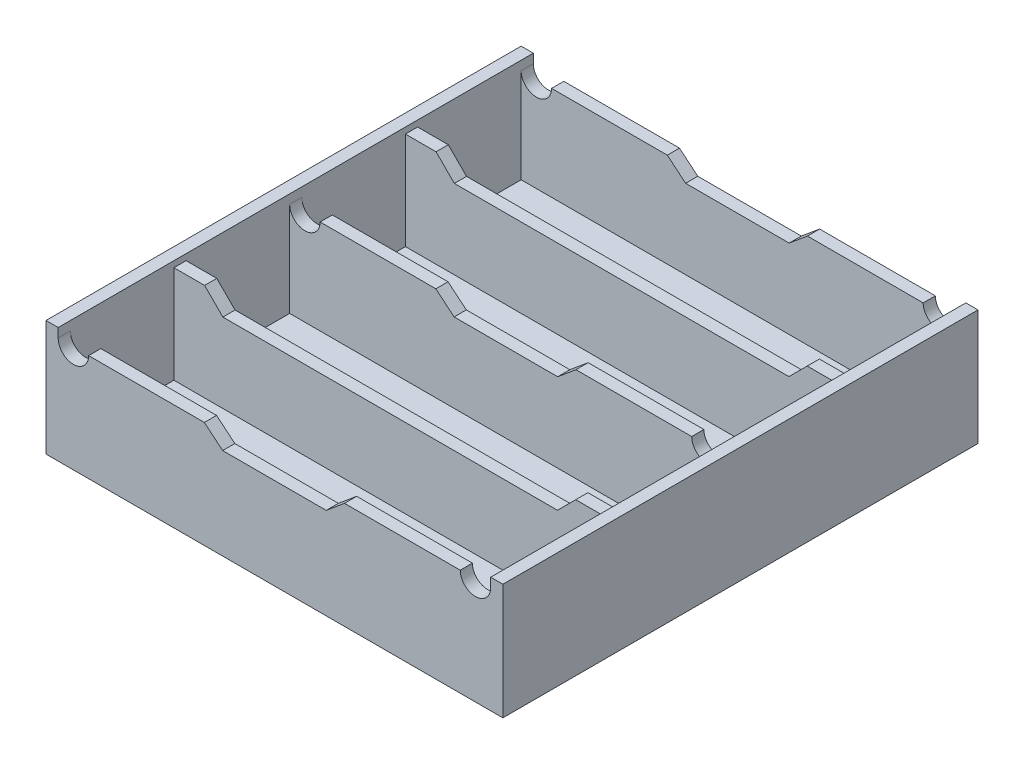
from build123d import *

# Parameters (mm, degrees)
SKETCH1_W            = 75
SKETCH1_H            = 40
BOSS_EXTRUDE1_DEPTH  = 2
SKETCH2_W            = 75
SKETCH2_H            = 40
SKETCH2_W_2          = 71
SKETCH2_H_2          = 17
BOSS_EXTRUDE2_DEPTH  = 17
CUT_EXTRUDE2_DEPTH   = 17
CUT_EXTRUDE3_REACH   = 82.169
CUT_EXTRUDE4_REACH   = 88.683
SKETCH5_R            = 1.6
MIRROR2_COPY_1_DEPTH = 17


with BuildPart() as part:
    # Sketch1 → Boss-Extrude1 (new body)
    with BuildSketch(Plane(origin=(0, 0, 0), x_dir=(1, 0, 0), z_dir=(0, 1, 0))):
        with Locations((37.5, 20)):
            Rectangle(SKETCH1_W, SKETCH1_H)
    boss_extrude1 = extrude(amount=BOSS_EXTRUDE1_DEPTH)

    # Sketch2 → Boss-Extrude2 (add)
    with BuildSketch(Plane(origin=(0, 2, 0), x_dir=(1, 0, 0), z_dir=(0, 1, 0))):
        with Locations((37.5, 20)):
            Rectangle(SKETCH2_W, SKETCH2_H)
        with Locations((37.5, 29.5)):
            Rectangle(SKETCH2_W_2, SKETCH2_H_2, mode=Mode.SUBTRACT)
        with Locations((37.5, 10.5)):
            Rectangle(SKETCH2_W_2, SKETCH2_H_2, mode=Mode.SUBTRACT)
    boss_extrude2 = extrude(amount=BOSS_EXTRUDE2_DEPTH)

    # Sketch3 → Cut-Extrude2 (cut)
    with BuildSketch(Plane.XY):
        with BuildLine():
            Line((2, 17.5), (2, 19))
            Line((2, 19), (73, 19))
            Line((73, 19), (73, 17.5))
            ThreePointArc((73, 17.5), (70.5, 15), (68, 17.5))
            Line((68, 17.5), (49, 17.5))
            Line((49, 17.5), (46, 15))
            Line((46, 15), (29, 15))
            Line((29, 15), (26, 17.5))
            Line((26, 17.5), (7, 17.5))
            ThreePointArc((7, 17.5), (4.5, 15), (2, 17.5))
        make_face()
    cut_extrude2 = extrude(amount=-CUT_EXTRUDE2_DEPTH, mode=Mode.SUBTRACT)

    # Mirror1: Cut-Extrude2 across plane
    add(cut_extrude2.mirror(Plane.XY.offset(-20)), mode=Mode.SUBTRACT)

    # Sketch4 → Cut-Extrude3 (cut, up to next)
    with BuildSketch(Plane.XY.offset(-19), mode=Mode.PRIVATE) as cut_extrude3_sk1:
        Polygon((2, 18), (7.035918341, 18), (10.035918341, 15), (64.964081659, 15), (67.964081659, 18), (73, 18), (73, 19), (2, 19), align=None)
    cut_extrude3_tool1 = extrude(cut_extrude3_sk1.sketch, amount=-CUT_EXTRUDE3_REACH, mode=Mode.PRIVATE) & part.part
    cut_extrude3 = cut_extrude3_tool1.solids().sort_by_distance((37.5, 17.098486, -19))[0]
    add(cut_extrude3, mode=Mode.SUBTRACT)

    # Sketch5 → Cut-Extrude4 (cut, up to next)
    with BuildSketch(Plane(origin=(0, 2, 0), x_dir=(1, 0, 0), z_dir=(0, 1, 0)), mode=Mode.PRIVATE) as cut_extrude4_sk1:
        with Locations(Location((37.5, 29.5, 0), (0, 0, 270))):
            Circle(SKETCH5_R)
    cut_extrude4_tool1 = extrude(cut_extrude4_sk1.sketch, amount=-CUT_EXTRUDE4_REACH, mode=Mode.PRIVATE) & part.part
    # Sketch5 → Cut-Extrude4 (cut, up to next)
    with BuildSketch(Plane(origin=(0, 2, 0), x_dir=(1, 0, 0), z_dir=(0, 1, 0)), mode=Mode.PRIVATE) as cut_extrude4_sk2:
        with Locations(Location((37.5, 10.5, 0), (0, 0, 270))):
            Circle(SKETCH5_R)
    cut_extrude4_tool2 = extrude(cut_extrude4_sk2.sketch, amount=-CUT_EXTRUDE4_REACH, mode=Mode.PRIVATE) & part.part
    cut_extrude4_1 = cut_extrude4_tool1.solids().sort_by_distance((37.5, 2, -29.5))[0]
    add(cut_extrude4_1, mode=Mode.SUBTRACT)
    cut_extrude4_2 = cut_extrude4_tool2.solids().sort_by_distance((37.5, 2, -10.5))[0]
    add(cut_extrude4_2, mode=Mode.SUBTRACT)
    cut_extrude4 = cut_extrude4_1 + cut_extrude4_2  # Cut-Extrude4 as one shape, for the pattern or mirror that repeats it

    # Mirror2: Boss-Extrude1, Boss-Extrude2, Cut-Extrude2, Cut-Extrude3, Cut-Extrude4 across plane
    add(boss_extrude1.mirror(Plane.XY.offset(-1)))
    add(boss_extrude2.mirror(Plane.XY.offset(-1)))
    add(cut_extrude2.mirror(Plane.XY.offset(-1)), mode=Mode.SUBTRACT)
    add(cut_extrude3.mirror(Plane.XY.offset(-1)), mode=Mode.SUBTRACT)
    add(cut_extrude4.mirror(Plane.XY.offset(-1)), mode=Mode.SUBTRACT)

    # Mirror2 copy 1 sketch → Mirror2 copy 1 (cut)
    with BuildSketch(Plane.XY.offset(38)):
        with BuildLine():
            Line((2, 17.5), (2, 19))
            Line((2, 19), (73, 19))
            Line((73, 19), (73, 17.5))
            ThreePointArc((73, 17.5), (70.5, 15), (68, 17.5))
            Line((68, 17.5), (49, 17.5))
            Line((49, 17.5), (46, 15))
            Line((46, 15), (29, 15))
            Line((29, 15), (26, 17.5))
            Line((26, 17.5), (7, 17.5))
            ThreePointArc((7, 17.5), (4.5, 15), (2, 17.5))
        make_face()
    extrude(amount=-MIRROR2_COPY_1_DEPTH, mode=Mode.SUBTRACT)


solid = part.part
